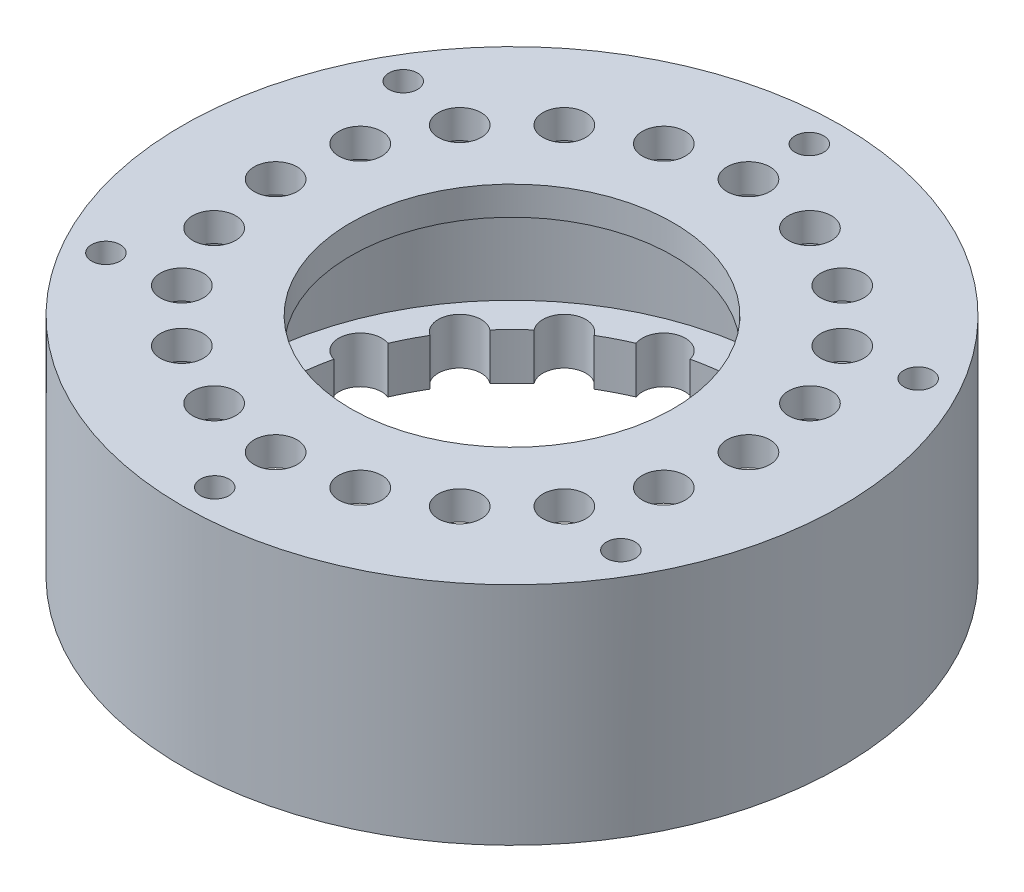
from build123d import *

# Parameters (mm, degrees)
SKETCH1_R           = 46
SKETCH1_R_2         = 22.5
BOSS_EXTRUDE1_DEPTH = 4
CUT_EXTRUDE1_REACH  = 67.177
SKETCH2_R           = 3
BOSS_EXTRUDE2_START = 21
SKETCH3_R           = 46
SKETCH3_R_2         = 38
BOSS_EXTRUDE2_DEPTH = 21
BOSS_EXTRUDE3_START = 6.5
SKETCH4_R           = 46
SKETCH4_R_2         = 33
BOSS_EXTRUDE3_DEPTH = 6.5
CUT_EXTRUDE2_REACH  = 74.279
SKETCH5_R           = 3
SKETCH6_R           = 2
CUT_EXTRUDE3_DEPTH  = 73.278973429


with BuildPart() as part:
    # Sketch1 → Boss-Extrude1 (new body)
    with BuildSketch(Plane(origin=(0, 0, 0), x_dir=(1, 0, 0), z_dir=(0, 1, 0))):
        Circle(SKETCH1_R)
        Circle(SKETCH1_R_2, mode=Mode.SUBTRACT)
    extrude(amount=BOSS_EXTRUDE1_DEPTH)

    # Sketch2 → Cut-Extrude1 (cut, up to next)
    with BuildSketch(Plane(origin=(0, 4, 0), x_dir=(1, 0, 0), z_dir=(0, 1, 0)), mode=Mode.PRIVATE) as cut_extrude1_sk1:
        with Locations((33, 0)):
            Circle(SKETCH2_R)
    cut_extrude1_tool1 = extrude(cut_extrude1_sk1.sketch, amount=-CUT_EXTRUDE1_REACH, mode=Mode.PRIVATE) & part.part
    # Sketch2 → Cut-Extrude1 (cut, up to next)
    with BuildSketch(Plane(origin=(0, 4, 0), x_dir=(1, 0, 0), z_dir=(0, 1, 0)), mode=Mode.PRIVATE) as cut_extrude1_sk2:
        with Locations((31.384865038, -10.197560814)):
            Circle(SKETCH2_R)
    cut_extrude1_tool2 = extrude(cut_extrude1_sk2.sketch, amount=-CUT_EXTRUDE1_REACH, mode=Mode.PRIVATE) & part.part
    # Sketch2 → Cut-Extrude1 (cut, up to next)
    with BuildSketch(Plane(origin=(0, 4, 0), x_dir=(1, 0, 0), z_dir=(0, 1, 0)), mode=Mode.PRIVATE) as cut_extrude1_sk3:
        with Locations((26.697560814, -19.396913326)):
            Circle(SKETCH2_R)
    cut_extrude1_tool3 = extrude(cut_extrude1_sk3.sketch, amount=-CUT_EXTRUDE1_REACH, mode=Mode.PRIVATE) & part.part
    # Sketch2 → Cut-Extrude1 (cut, up to next)
    with BuildSketch(Plane(origin=(0, 4, 0), x_dir=(1, 0, 0), z_dir=(0, 1, 0)), mode=Mode.PRIVATE) as cut_extrude1_sk4:
        with Locations((19.396913326, -26.697560814)):
            Circle(SKETCH2_R)
    cut_extrude1_tool4 = extrude(cut_extrude1_sk4.sketch, amount=-CUT_EXTRUDE1_REACH, mode=Mode.PRIVATE) & part.part
    # Sketch2 → Cut-Extrude1 (cut, up to next)
    with BuildSketch(Plane(origin=(0, 4, 0), x_dir=(1, 0, 0), z_dir=(0, 1, 0)), mode=Mode.PRIVATE) as cut_extrude1_sk5:
        with Locations((10.197560814, -31.384865038)):
            Circle(SKETCH2_R)
    cut_extrude1_tool5 = extrude(cut_extrude1_sk5.sketch, amount=-CUT_EXTRUDE1_REACH, mode=Mode.PRIVATE) & part.part
    # Sketch2 → Cut-Extrude1 (cut, up to next)
    with BuildSketch(Plane(origin=(0, 4, 0), x_dir=(1, 0, 0), z_dir=(0, 1, 0)), mode=Mode.PRIVATE) as cut_extrude1_sk6:
        with Locations((0, -33)):
            Circle(SKETCH2_R)
    cut_extrude1_tool6 = extrude(cut_extrude1_sk6.sketch, amount=-CUT_EXTRUDE1_REACH, mode=Mode.PRIVATE) & part.part
    # Sketch2 → Cut-Extrude1 (cut, up to next)
    with BuildSketch(Plane(origin=(0, 4, 0), x_dir=(1, 0, 0), z_dir=(0, 1, 0)), mode=Mode.PRIVATE) as cut_extrude1_sk7:
        with Locations((-10.197560814, -31.384865038)):
            Circle(SKETCH2_R)
    cut_extrude1_tool7 = extrude(cut_extrude1_sk7.sketch, amount=-CUT_EXTRUDE1_REACH, mode=Mode.PRIVATE) & part.part
    # Sketch2 → Cut-Extrude1 (cut, up to next)
    with BuildSketch(Plane(origin=(0, 4, 0), x_dir=(1, 0, 0), z_dir=(0, 1, 0)), mode=Mode.PRIVATE) as cut_extrude1_sk8:
        with Locations((-19.396913326, -26.697560814)):
            Circle(SKETCH2_R)
    cut_extrude1_tool8 = extrude(cut_extrude1_sk8.sketch, amount=-CUT_EXTRUDE1_REACH, mode=Mode.PRIVATE) & part.part
    # Sketch2 → Cut-Extrude1 (cut, up to next)
    with BuildSketch(Plane(origin=(0, 4, 0), x_dir=(1, 0, 0), z_dir=(0, 1, 0)), mode=Mode.PRIVATE) as cut_extrude1_sk9:
        with Locations((-26.697560814, -19.396913326)):
            Circle(SKETCH2_R)
    cut_extrude1_tool9 = extrude(cut_extrude1_sk9.sketch, amount=-CUT_EXTRUDE1_REACH, mode=Mode.PRIVATE) & part.part
    # Sketch2 → Cut-Extrude1 (cut, up to next)
    with BuildSketch(Plane(origin=(0, 4, 0), x_dir=(1, 0, 0), z_dir=(0, 1, 0)), mode=Mode.PRIVATE) as cut_extrude1_sk10:
        with Locations((-31.384865038, -10.197560814)):
            Circle(SKETCH2_R)
    cut_extrude1_tool10 = extrude(cut_extrude1_sk10.sketch, amount=-CUT_EXTRUDE1_REACH, mode=Mode.PRIVATE) & part.part
    # Sketch2 → Cut-Extrude1 (cut, up to next)
    with BuildSketch(Plane(origin=(0, 4, 0), x_dir=(1, 0, 0), z_dir=(0, 1, 0)), mode=Mode.PRIVATE) as cut_extrude1_sk11:
        with Locations((-33, 0)):
            Circle(SKETCH2_R)
    cut_extrude1_tool11 = extrude(cut_extrude1_sk11.sketch, amount=-CUT_EXTRUDE1_REACH, mode=Mode.PRIVATE) & part.part
    # Sketch2 → Cut-Extrude1 (cut, up to next)
    with BuildSketch(Plane(origin=(0, 4, 0), x_dir=(1, 0, 0), z_dir=(0, 1, 0)), mode=Mode.PRIVATE) as cut_extrude1_sk12:
        with Locations((-31.384865038, 10.197560814)):
            Circle(SKETCH2_R)
    cut_extrude1_tool12 = extrude(cut_extrude1_sk12.sketch, amount=-CUT_EXTRUDE1_REACH, mode=Mode.PRIVATE) & part.part
    # Sketch2 → Cut-Extrude1 (cut, up to next)
    with BuildSketch(Plane(origin=(0, 4, 0), x_dir=(1, 0, 0), z_dir=(0, 1, 0)), mode=Mode.PRIVATE) as cut_extrude1_sk13:
        with Locations((-26.697560814, 19.396913326)):
            Circle(SKETCH2_R)
    cut_extrude1_tool13 = extrude(cut_extrude1_sk13.sketch, amount=-CUT_EXTRUDE1_REACH, mode=Mode.PRIVATE) & part.part
    # Sketch2 → Cut-Extrude1 (cut, up to next)
    with BuildSketch(Plane(origin=(0, 4, 0), x_dir=(1, 0, 0), z_dir=(0, 1, 0)), mode=Mode.PRIVATE) as cut_extrude1_sk14:
        with Locations((-19.396913326, 26.697560814)):
            Circle(SKETCH2_R)
    cut_extrude1_tool14 = extrude(cut_extrude1_sk14.sketch, amount=-CUT_EXTRUDE1_REACH, mode=Mode.PRIVATE) & part.part
    # Sketch2 → Cut-Extrude1 (cut, up to next)
    with BuildSketch(Plane(origin=(0, 4, 0), x_dir=(1, 0, 0), z_dir=(0, 1, 0)), mode=Mode.PRIVATE) as cut_extrude1_sk15:
        with Locations((-10.197560814, 31.384865038)):
            Circle(SKETCH2_R)
    cut_extrude1_tool15 = extrude(cut_extrude1_sk15.sketch, amount=-CUT_EXTRUDE1_REACH, mode=Mode.PRIVATE) & part.part
    # Sketch2 → Cut-Extrude1 (cut, up to next)
    with BuildSketch(Plane(origin=(0, 4, 0), x_dir=(1, 0, 0), z_dir=(0, 1, 0)), mode=Mode.PRIVATE) as cut_extrude1_sk16:
        with Locations((0, 33)):
            Circle(SKETCH2_R)
    cut_extrude1_tool16 = extrude(cut_extrude1_sk16.sketch, amount=-CUT_EXTRUDE1_REACH, mode=Mode.PRIVATE) & part.part
    # Sketch2 → Cut-Extrude1 (cut, up to next)
    with BuildSketch(Plane(origin=(0, 4, 0), x_dir=(1, 0, 0), z_dir=(0, 1, 0)), mode=Mode.PRIVATE) as cut_extrude1_sk17:
        with Locations((10.197560814, 31.384865038)):
            Circle(SKETCH2_R)
    cut_extrude1_tool17 = extrude(cut_extrude1_sk17.sketch, amount=-CUT_EXTRUDE1_REACH, mode=Mode.PRIVATE) & part.part
    # Sketch2 → Cut-Extrude1 (cut, up to next)
    with BuildSketch(Plane(origin=(0, 4, 0), x_dir=(1, 0, 0), z_dir=(0, 1, 0)), mode=Mode.PRIVATE) as cut_extrude1_sk18:
        with Locations((19.396913326, 26.697560814)):
            Circle(SKETCH2_R)
    cut_extrude1_tool18 = extrude(cut_extrude1_sk18.sketch, amount=-CUT_EXTRUDE1_REACH, mode=Mode.PRIVATE) & part.part
    # Sketch2 → Cut-Extrude1 (cut, up to next)
    with BuildSketch(Plane(origin=(0, 4, 0), x_dir=(1, 0, 0), z_dir=(0, 1, 0)), mode=Mode.PRIVATE) as cut_extrude1_sk19:
        with Locations((26.697560814, 19.396913326)):
            Circle(SKETCH2_R)
    cut_extrude1_tool19 = extrude(cut_extrude1_sk19.sketch, amount=-CUT_EXTRUDE1_REACH, mode=Mode.PRIVATE) & part.part
    # Sketch2 → Cut-Extrude1 (cut, up to next)
    with BuildSketch(Plane(origin=(0, 4, 0), x_dir=(1, 0, 0), z_dir=(0, 1, 0)), mode=Mode.PRIVATE) as cut_extrude1_sk20:
        with Locations((31.384865038, 10.197560814)):
            Circle(SKETCH2_R)
    cut_extrude1_tool20 = extrude(cut_extrude1_sk20.sketch, amount=-CUT_EXTRUDE1_REACH, mode=Mode.PRIVATE) & part.part
    add(cut_extrude1_tool1.solids().sort_by_distance((33, 4, 0))[0], mode=Mode.SUBTRACT)
    add(cut_extrude1_tool2.solids().sort_by_distance((31.384865, 4, 10.197561))[0], mode=Mode.SUBTRACT)
    add(cut_extrude1_tool3.solids().sort_by_distance((26.697561, 4, 19.396913))[0], mode=Mode.SUBTRACT)
    add(cut_extrude1_tool4.solids().sort_by_distance((19.396913, 4, 26.697561))[0], mode=Mode.SUBTRACT)
    add(cut_extrude1_tool5.solids().sort_by_distance((10.197561, 4, 31.384865))[0], mode=Mode.SUBTRACT)
    add(cut_extrude1_tool6.solids().sort_by_distance((0, 4, 33))[0], mode=Mode.SUBTRACT)
    add(cut_extrude1_tool7.solids().sort_by_distance((-10.197561, 4, 31.384865))[0], mode=Mode.SUBTRACT)
    add(cut_extrude1_tool8.solids().sort_by_distance((-19.396913, 4, 26.697561))[0], mode=Mode.SUBTRACT)
    add(cut_extrude1_tool9.solids().sort_by_distance((-26.697561, 4, 19.396913))[0], mode=Mode.SUBTRACT)
    add(cut_extrude1_tool10.solids().sort_by_distance((-31.384865, 4, 10.197561))[0], mode=Mode.SUBTRACT)
    add(cut_extrude1_tool11.solids().sort_by_distance((-33, 4, 0))[0], mode=Mode.SUBTRACT)
    add(cut_extrude1_tool12.solids().sort_by_distance((-31.384865, 4, -10.197561))[0], mode=Mode.SUBTRACT)
    add(cut_extrude1_tool13.solids().sort_by_distance((-26.697561, 4, -19.396913))[0], mode=Mode.SUBTRACT)
    add(cut_extrude1_tool14.solids().sort_by_distance((-19.396913, 4, -26.697561))[0], mode=Mode.SUBTRACT)
    add(cut_extrude1_tool15.solids().sort_by_distance((-10.197561, 4, -31.384865))[0], mode=Mode.SUBTRACT)
    add(cut_extrude1_tool16.solids().sort_by_distance((0, 4, -33))[0], mode=Mode.SUBTRACT)
    add(cut_extrude1_tool17.solids().sort_by_distance((10.197561, 4, -31.384865))[0], mode=Mode.SUBTRACT)
    add(cut_extrude1_tool18.solids().sort_by_distance((19.396913, 4, -26.697561))[0], mode=Mode.SUBTRACT)
    add(cut_extrude1_tool19.solids().sort_by_distance((26.697561, 4, -19.396913))[0], mode=Mode.SUBTRACT)
    add(cut_extrude1_tool20.solids().sort_by_distance((31.384865, 4, -10.197561))[0], mode=Mode.SUBTRACT)

    # Sketch3 → Boss-Extrude2 (add)
    with BuildSketch(Plane.XZ.offset(BOSS_EXTRUDE2_START)):
        Circle(SKETCH3_R)
        Circle(SKETCH3_R_2, mode=Mode.SUBTRACT)
    extrude(amount=-BOSS_EXTRUDE2_DEPTH)

    # Sketch4 → Boss-Extrude3 (add)
    with BuildSketch(Plane.XZ.offset(21).offset(BOSS_EXTRUDE3_START)):
        Circle(SKETCH4_R)
        Circle(SKETCH4_R_2, mode=Mode.SUBTRACT)
    extrude(amount=-BOSS_EXTRUDE3_DEPTH)

    # Sketch5 → Cut-Extrude2 (cut, up to next)
    with BuildSketch(Plane.XZ.offset(27.5), mode=Mode.PRIVATE) as cut_extrude2_sk1:
        with Locations((26.697560814, -19.396913326)):
            Circle(SKETCH5_R)
    cut_extrude2_tool1 = extrude(cut_extrude2_sk1.sketch, amount=-CUT_EXTRUDE2_REACH, mode=Mode.PRIVATE) & part.part
    # Sketch5 → Cut-Extrude2 (cut, up to next)
    with BuildSketch(Plane.XZ.offset(27.5), mode=Mode.PRIVATE) as cut_extrude2_sk2:
        with Locations((19.396913326, -26.697560814)):
            Circle(SKETCH5_R)
    cut_extrude2_tool2 = extrude(cut_extrude2_sk2.sketch, amount=-CUT_EXTRUDE2_REACH, mode=Mode.PRIVATE) & part.part
    # Sketch5 → Cut-Extrude2 (cut, up to next)
    with BuildSketch(Plane.XZ.offset(27.5), mode=Mode.PRIVATE) as cut_extrude2_sk3:
        with Locations((10.197560814, -31.384865038)):
            Circle(SKETCH5_R)
    cut_extrude2_tool3 = extrude(cut_extrude2_sk3.sketch, amount=-CUT_EXTRUDE2_REACH, mode=Mode.PRIVATE) & part.part
    # Sketch5 → Cut-Extrude2 (cut, up to next)
    with BuildSketch(Plane.XZ.offset(27.5), mode=Mode.PRIVATE) as cut_extrude2_sk4:
        with Locations((0, -33)):
            Circle(SKETCH5_R)
    cut_extrude2_tool4 = extrude(cut_extrude2_sk4.sketch, amount=-CUT_EXTRUDE2_REACH, mode=Mode.PRIVATE) & part.part
    # Sketch5 → Cut-Extrude2 (cut, up to next)
    with BuildSketch(Plane.XZ.offset(27.5), mode=Mode.PRIVATE) as cut_extrude2_sk5:
        with Locations((-10.197560814, -31.384865038)):
            Circle(SKETCH5_R)
    cut_extrude2_tool5 = extrude(cut_extrude2_sk5.sketch, amount=-CUT_EXTRUDE2_REACH, mode=Mode.PRIVATE) & part.part
    # Sketch5 → Cut-Extrude2 (cut, up to next)
    with BuildSketch(Plane.XZ.offset(27.5), mode=Mode.PRIVATE) as cut_extrude2_sk6:
        with Locations((-19.396913326, -26.697560814)):
            Circle(SKETCH5_R)
    cut_extrude2_tool6 = extrude(cut_extrude2_sk6.sketch, amount=-CUT_EXTRUDE2_REACH, mode=Mode.PRIVATE) & part.part
    # Sketch5 → Cut-Extrude2 (cut, up to next)
    with BuildSketch(Plane.XZ.offset(27.5), mode=Mode.PRIVATE) as cut_extrude2_sk7:
        with Locations((-26.697560814, -19.396913326)):
            Circle(SKETCH5_R)
    cut_extrude2_tool7 = extrude(cut_extrude2_sk7.sketch, amount=-CUT_EXTRUDE2_REACH, mode=Mode.PRIVATE) & part.part
    # Sketch5 → Cut-Extrude2 (cut, up to next)
    with BuildSketch(Plane.XZ.offset(27.5), mode=Mode.PRIVATE) as cut_extrude2_sk8:
        with Locations((-31.384865038, -10.197560814)):
            Circle(SKETCH5_R)
    cut_extrude2_tool8 = extrude(cut_extrude2_sk8.sketch, amount=-CUT_EXTRUDE2_REACH, mode=Mode.PRIVATE) & part.part
    # Sketch5 → Cut-Extrude2 (cut, up to next)
    with BuildSketch(Plane.XZ.offset(27.5), mode=Mode.PRIVATE) as cut_extrude2_sk9:
        with Locations((-33, 0)):
            Circle(SKETCH5_R)
    cut_extrude2_tool9 = extrude(cut_extrude2_sk9.sketch, amount=-CUT_EXTRUDE2_REACH, mode=Mode.PRIVATE) & part.part
    # Sketch5 → Cut-Extrude2 (cut, up to next)
    with BuildSketch(Plane.XZ.offset(27.5), mode=Mode.PRIVATE) as cut_extrude2_sk10:
        with Locations((-31.384865038, 10.197560814)):
            Circle(SKETCH5_R)
    cut_extrude2_tool10 = extrude(cut_extrude2_sk10.sketch, amount=-CUT_EXTRUDE2_REACH, mode=Mode.PRIVATE) & part.part
    # Sketch5 → Cut-Extrude2 (cut, up to next)
    with BuildSketch(Plane.XZ.offset(27.5), mode=Mode.PRIVATE) as cut_extrude2_sk11:
        with Locations((-26.697560814, 19.396913326)):
            Circle(SKETCH5_R)
    cut_extrude2_tool11 = extrude(cut_extrude2_sk11.sketch, amount=-CUT_EXTRUDE2_REACH, mode=Mode.PRIVATE) & part.part
    # Sketch5 → Cut-Extrude2 (cut, up to next)
    with BuildSketch(Plane.XZ.offset(27.5), mode=Mode.PRIVATE) as cut_extrude2_sk12:
        with Locations((-19.396913326, 26.697560814)):
            Circle(SKETCH5_R)
    cut_extrude2_tool12 = extrude(cut_extrude2_sk12.sketch, amount=-CUT_EXTRUDE2_REACH, mode=Mode.PRIVATE) & part.part
    # Sketch5 → Cut-Extrude2 (cut, up to next)
    with BuildSketch(Plane.XZ.offset(27.5), mode=Mode.PRIVATE) as cut_extrude2_sk13:
        with Locations((-10.197560814, 31.384865038)):
            Circle(SKETCH5_R)
    cut_extrude2_tool13 = extrude(cut_extrude2_sk13.sketch, amount=-CUT_EXTRUDE2_REACH, mode=Mode.PRIVATE) & part.part
    # Sketch5 → Cut-Extrude2 (cut, up to next)
    with BuildSketch(Plane.XZ.offset(27.5), mode=Mode.PRIVATE) as cut_extrude2_sk14:
        with Locations((0, 33)):
            Circle(SKETCH5_R)
    cut_extrude2_tool14 = extrude(cut_extrude2_sk14.sketch, amount=-CUT_EXTRUDE2_REACH, mode=Mode.PRIVATE) & part.part
    # Sketch5 → Cut-Extrude2 (cut, up to next)
    with BuildSketch(Plane.XZ.offset(27.5), mode=Mode.PRIVATE) as cut_extrude2_sk15:
        with Locations((10.197560814, 31.384865038)):
            Circle(SKETCH5_R)
    cut_extrude2_tool15 = extrude(cut_extrude2_sk15.sketch, amount=-CUT_EXTRUDE2_REACH, mode=Mode.PRIVATE) & part.part
    # Sketch5 → Cut-Extrude2 (cut, up to next)
    with BuildSketch(Plane.XZ.offset(27.5), mode=Mode.PRIVATE) as cut_extrude2_sk16:
        with Locations((19.396913326, 26.697560814)):
            Circle(SKETCH5_R)
    cut_extrude2_tool16 = extrude(cut_extrude2_sk16.sketch, amount=-CUT_EXTRUDE2_REACH, mode=Mode.PRIVATE) & part.part
    # Sketch5 → Cut-Extrude2 (cut, up to next)
    with BuildSketch(Plane.XZ.offset(27.5), mode=Mode.PRIVATE) as cut_extrude2_sk17:
        with Locations((26.697560814, 19.396913326)):
            Circle(SKETCH5_R)
    cut_extrude2_tool17 = extrude(cut_extrude2_sk17.sketch, amount=-CUT_EXTRUDE2_REACH, mode=Mode.PRIVATE) & part.part
    # Sketch5 → Cut-Extrude2 (cut, up to next)
    with BuildSketch(Plane.XZ.offset(27.5), mode=Mode.PRIVATE) as cut_extrude2_sk18:
        with Locations((31.384865038, 10.197560814)):
            Circle(SKETCH5_R)
    cut_extrude2_tool18 = extrude(cut_extrude2_sk18.sketch, amount=-CUT_EXTRUDE2_REACH, mode=Mode.PRIVATE) & part.part
    # Sketch5 → Cut-Extrude2 (cut, up to next)
    with BuildSketch(Plane.XZ.offset(27.5), mode=Mode.PRIVATE) as cut_extrude2_sk19:
        with Locations((33, 0)):
            Circle(SKETCH5_R)
    cut_extrude2_tool19 = extrude(cut_extrude2_sk19.sketch, amount=-CUT_EXTRUDE2_REACH, mode=Mode.PRIVATE) & part.part
    # Sketch5 → Cut-Extrude2 (cut, up to next)
    with BuildSketch(Plane.XZ.offset(27.5), mode=Mode.PRIVATE) as cut_extrude2_sk20:
        with Locations((31.384865038, -10.197560814)):
            Circle(SKETCH5_R)
    cut_extrude2_tool20 = extrude(cut_extrude2_sk20.sketch, amount=-CUT_EXTRUDE2_REACH, mode=Mode.PRIVATE) & part.part
    add(cut_extrude2_tool1.solids().sort_by_distance((26.697561, -27.5, -19.396913))[0], mode=Mode.SUBTRACT)
    add(cut_extrude2_tool2.solids().sort_by_distance((19.396913, -27.5, -26.697561))[0], mode=Mode.SUBTRACT)
    add(cut_extrude2_tool3.solids().sort_by_distance((10.197561, -27.5, -31.384865))[0], mode=Mode.SUBTRACT)
    add(cut_extrude2_tool4.solids().sort_by_distance((0, -27.5, -33))[0], mode=Mode.SUBTRACT)
    add(cut_extrude2_tool5.solids().sort_by_distance((-10.197561, -27.5, -31.384865))[0], mode=Mode.SUBTRACT)
    add(cut_extrude2_tool6.solids().sort_by_distance((-19.396913, -27.5, -26.697561))[0], mode=Mode.SUBTRACT)
    add(cut_extrude2_tool7.solids().sort_by_distance((-26.697561, -27.5, -19.396913))[0], mode=Mode.SUBTRACT)
    add(cut_extrude2_tool8.solids().sort_by_distance((-31.384865, -27.5, -10.197561))[0], mode=Mode.SUBTRACT)
    add(cut_extrude2_tool9.solids().sort_by_distance((-33, -27.5, 0))[0], mode=Mode.SUBTRACT)
    add(cut_extrude2_tool10.solids().sort_by_distance((-31.384865, -27.5, 10.197561))[0], mode=Mode.SUBTRACT)
    add(cut_extrude2_tool11.solids().sort_by_distance((-26.697561, -27.5, 19.396913))[0], mode=Mode.SUBTRACT)
    add(cut_extrude2_tool12.solids().sort_by_distance((-19.396913, -27.5, 26.697561))[0], mode=Mode.SUBTRACT)
    add(cut_extrude2_tool13.solids().sort_by_distance((-10.197561, -27.5, 31.384865))[0], mode=Mode.SUBTRACT)
    add(cut_extrude2_tool14.solids().sort_by_distance((0, -27.5, 33))[0], mode=Mode.SUBTRACT)
    add(cut_extrude2_tool15.solids().sort_by_distance((10.197561, -27.5, 31.384865))[0], mode=Mode.SUBTRACT)
    add(cut_extrude2_tool16.solids().sort_by_distance((19.396913, -27.5, 26.697561))[0], mode=Mode.SUBTRACT)
    add(cut_extrude2_tool17.solids().sort_by_distance((26.697561, -27.5, 19.396913))[0], mode=Mode.SUBTRACT)
    add(cut_extrude2_tool18.solids().sort_by_distance((31.384865, -27.5, 10.197561))[0], mode=Mode.SUBTRACT)
    add(cut_extrude2_tool19.solids().sort_by_distance((33, -27.5, 0))[0], mode=Mode.SUBTRACT)
    add(cut_extrude2_tool20.solids().sort_by_distance((31.384865, -27.5, -10.197561))[0], mode=Mode.SUBTRACT)

    # Sketch6 → Cut-Extrude3 (cut, through all)
    with BuildSketch(Plane.XZ.offset(27.5)):
        with Locations((0, 41.5)):
            Circle(SKETCH6_R)
        with Locations((35.940054257, 20.75)):
            Circle(SKETCH6_R)
        with Locations((35.940054257, -20.75)):
            Circle(SKETCH6_R)
        with Locations((0, -41.5)):
            Circle(SKETCH6_R)
        with Locations((-35.940054257, -20.75)):
            Circle(SKETCH6_R)
        with Locations((-35.940054257, 20.75)):
            Circle(SKETCH6_R)
    extrude(amount=-CUT_EXTRUDE3_DEPTH, mode=Mode.SUBTRACT)


solid = part.part
